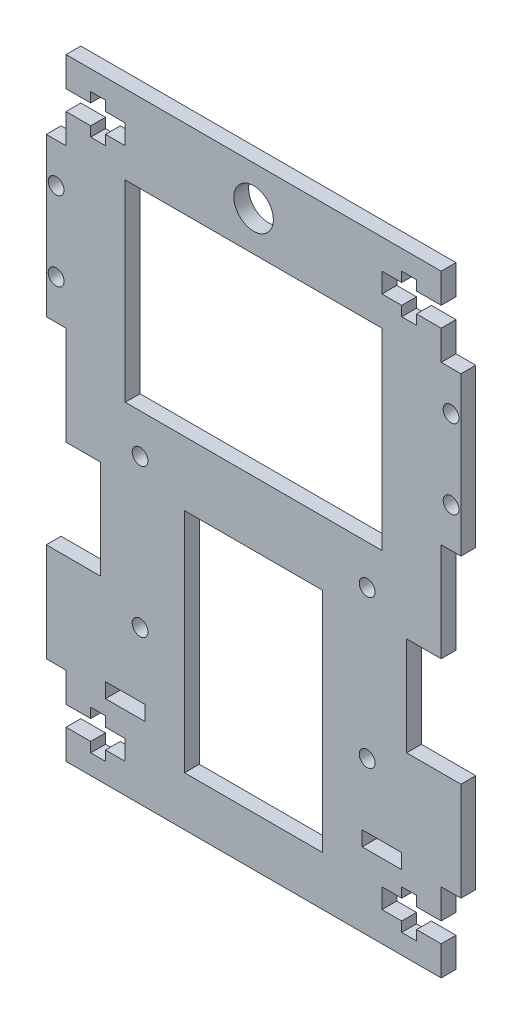
from build123d import *

# Parameters (mm, degrees)
SKETCH_1_W      = 8
SKETCH_1_H      = 3
SKETCH_1_R      = 1.6
SKETCH_1_W_2    = 28
SKETCH_1_H_2    = 46
SKETCH_1_W_3    = 52
SKETCH_1_H_3    = 39
SKETCH_1_R_2    = 4
EXTRUDE_1_DEPTH = 3


with BuildPart() as part:
    # 草图1 → 凸台-拉伸1 (new body)
    with BuildSketch(Plane.XY):
        Polygon((-42, 70), (-42, 54), (-42, 38), (-38, 38), (-38, 18), (-31, 18), (-31, -2), (-38, -2), (-42, -2), (-42, -22), (-38, -22), (-38, -28), (-33, -28), (-33, -26), (-30, -26), (-30, -28), (-26, -28), (-26, -32), (-30, -32), (-30, -34), (-33, -34), (-33, -32), (-38, -32), (-38, -38), (38, -38), (38, -32), (33, -32), (33, -34), (30, -34), (30, -32), (26, -32), (26, -28), (30, -28), (30, -26), (33, -26), (33, -28), (38, -28), (38, -22), (42, -22), (42, -2), (38, -2), (31, -2), (31, 18), (38, 18), (38, 38), (42, 38), (42, 54), (42, 70), (38, 70), (38, 76), (33, 76), (33, 74), (30, 74), (30, 76), (26, 76), (26, 80), (30, 80), (30, 82), (33, 82), (33, 80), (38, 80), (38, 86), (-38, 86), (-38, 80), (-33, 80), (-33, 82), (-30, 82), (-30, 80), (-26, 80), (-26, 76), (-30, 76), (-30, 74), (-33, 74), (-33, 76), (-38, 76), (-38, 70), align=None)
        with Locations((-26, -21.5)):
            Rectangle(SKETCH_1_W, SKETCH_1_H, mode=Mode.SUBTRACT)
        with Locations((-23, -7)):
            Circle(SKETCH_1_R, mode=Mode.SUBTRACT)
        with Locations((-23, 23)):
            Circle(SKETCH_1_R, mode=Mode.SUBTRACT)
        with Locations((26, -21.5)):
            Rectangle(SKETCH_1_W, SKETCH_1_H, mode=Mode.SUBTRACT)
        with Locations((0, -5)):
            Rectangle(SKETCH_1_W_2, SKETCH_1_H_2, mode=Mode.SUBTRACT)
        with Locations((23, -7)):
            Circle(SKETCH_1_R, mode=Mode.SUBTRACT)
        with Locations((23, 23)):
            Circle(SKETCH_1_R, mode=Mode.SUBTRACT)
        with Locations((-40, 46)):
            Circle(SKETCH_1_R, mode=Mode.SUBTRACT)
        with Locations((0, 50.5)):
            Rectangle(SKETCH_1_W_3, SKETCH_1_H_3, mode=Mode.SUBTRACT)
        with Locations((-40, 62)):
            Circle(SKETCH_1_R, mode=Mode.SUBTRACT)
        with Locations((40, 46)):
            Circle(SKETCH_1_R, mode=Mode.SUBTRACT)
        with Locations((0, 78)):
            Circle(SKETCH_1_R_2, mode=Mode.SUBTRACT)
        with Locations((40, 62)):
            Circle(SKETCH_1_R, mode=Mode.SUBTRACT)
    extrude(amount=EXTRUDE_1_DEPTH)


solid = part.part
